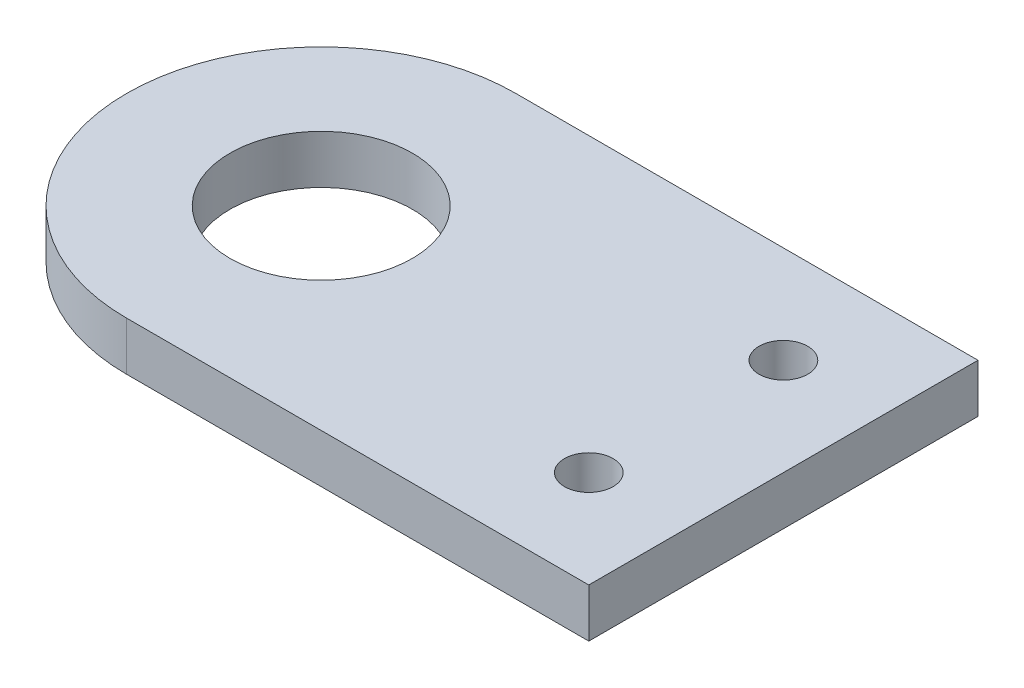
from build123d import *

# Parameters (mm, degrees)
SKETCH1_R           = 16
SKETCH1_R_2         = 7.5
BOSS_EXTRUDE1_DEPTH = 4
SKETCH2_R           = 2
CUT_EXTRUDE1_DEPTH  = 42.424630354


with BuildPart() as part:
    # Sketch1 → Boss-Extrude1 (new body)
    # profile 1 of 2: a face of its own
    with BuildSketch(Plane(origin=(0, 0, 0), x_dir=(1, 0, 0), z_dir=(0, 1, 0))):
        Circle(SKETCH1_R)
        with Locations(Location((0, 0, 0), (0, 0, 270))):
            Circle(SKETCH1_R_2, mode=Mode.SUBTRACT)
    # profile 2 of 2: a face of its own
    with BuildSketch(Plane(origin=(0, 0, 0), x_dir=(1, 0, 0), z_dir=(0, 1, 0))):
        with BuildLine():
            Line((38, 16), (0, 16))
            ThreePointArc((0, 16), (11.313708499, 11.313708499), (16, 0))
            ThreePointArc((16, 0), (11.313708499, -11.313708499), (0, -16))
            Line((0, -16), (38, -16))
            Line((38, -16), (38, 16))
        make_face()
    extrude(amount=BOSS_EXTRUDE1_DEPTH)

    # Sketch2 → Cut-Extrude1 (cut, through all)
    with BuildSketch(Plane(origin=(0, 4, 0), x_dir=(1, 0, 0), z_dir=(0, 1, 0))):
        with Locations(Location((30, -8, 0), (0, 0, 270))):
            Circle(SKETCH2_R)
        with Locations(Location((30, 8, 0), (0, 0, 270))):
            Circle(SKETCH2_R)
    extrude(amount=-CUT_EXTRUDE1_DEPTH, mode=Mode.SUBTRACT)


solid = part.part
